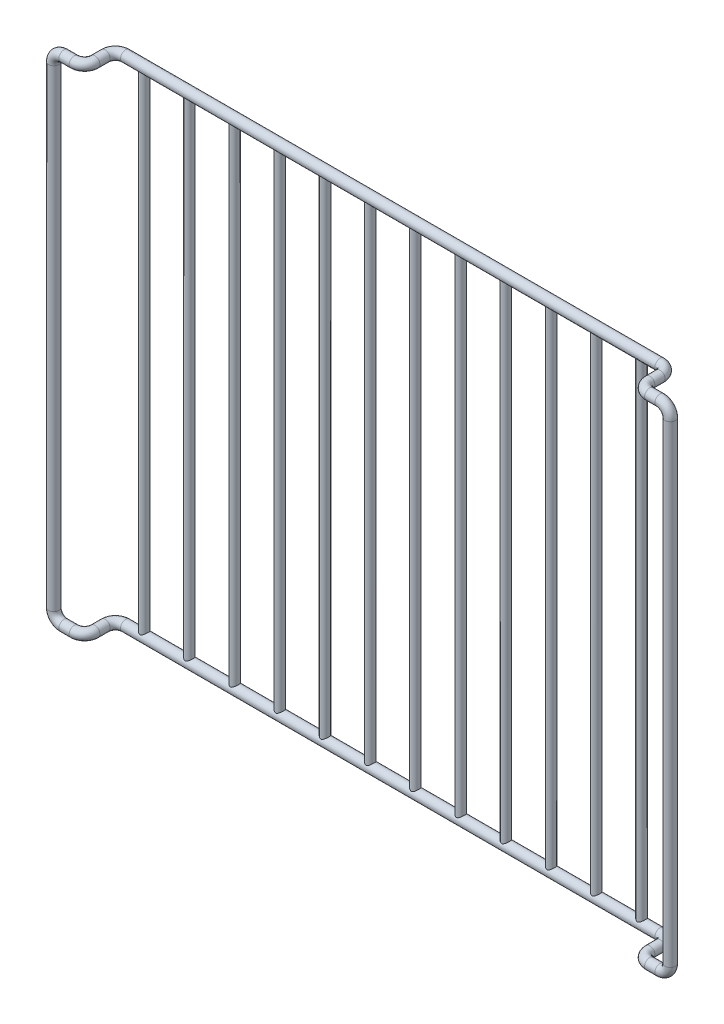
from build123d import *

# Parameters (mm, degrees)
SKETCH1_R                = 2.5
BOSS_EXTRUDE1_REACH      = 289
BOSS_EXTRUDE1_END_RADIUS = 2.5
SKETCH3_R                = 2
LPATTERN1_COUNT          = 6
LPATTERN1_PITCH          = 22


with BuildPart() as part:
    # Sweep1: sweep along a curve in space
    with BuildLine() as sweep1_path:
        Line((0, 0, 0), (130, 0, 0))
        ThreePointArc((135, 0, 5), (133.535533906, 0, 1.464466094), (130, 0, 0))
        Line((135, 0, 5), (135, 0, 10))
        ThreePointArc((140, 0, 15), (136.464466094, 0, 13.535533906), (135, 0, 10))
        Line((140, 0, 15), (145, 0, 15))
        ThreePointArc((145, 0, 15), (148.535533906, -1.464466094, 15), (150, -5, 15))
        Line((150, -5, 15), (150, -235, 15))
        ThreePointArc((150, -235, 15), (148.535533906, -238.535533906, 15), (145, -240, 15))
        Line((145, -240, 15), (140, -240, 15))
        ThreePointArc((140, -240, 15), (136.464466094, -240, 13.535533906), (135, -240, 10))
        Line((135, -240, 10), (135, -240, 5))
        ThreePointArc((135, -240, 5), (133.535533906, -240, 1.464466094), (130, -240, 0))
        Line((130, -240, 0), (0, -240, 0))
    # Sketch1 → Sweep1 (sweep)
    with BuildSketch(Plane(origin=(0, 0, 0), x_dir=(0, 0, -1), z_dir=(1, 0, 0))):
        Circle(SKETCH1_R)
    sweep(path=sweep1_path.line)

    # Boss-Extrude1: up to this cylinder (the profile starts outside it)
    boss_extrude1_end = Plane(origin=(11, -240, 0), z_dir=(-1, 0, 0)) * Cylinder(BOSS_EXTRUDE1_END_RADIUS, 584, mode=Mode.PRIVATE)
    # Sketch3 → Boss-Extrude1 (add, up to the surface)
    with BuildSketch(Plane(origin=(0, 0, 0), x_dir=(1, 0, 0), z_dir=(0, 1, 0)), mode=Mode.PRIVATE) as boss_extrude1_sk1:
        with Locations(Location((11, 0, 0), (0, 0, 270))):
            Circle(SKETCH3_R)
    boss_extrude1_tool1 = extrude(boss_extrude1_sk1.sketch, amount=-BOSS_EXTRUDE1_REACH, mode=Mode.PRIVATE) - boss_extrude1_end
    boss_extrude1 = boss_extrude1_tool1.solids().sort_by_distance((11, 0, 0))[0]
    add(boss_extrude1)

    # LPattern1: Boss-Extrude1 ×6
    with Locations(*[(i * LPATTERN1_PITCH, 0, 0) for i in range(1, LPATTERN1_COUNT)]):
        add(boss_extrude1)

    # Mirror1: part across plane


with BuildPart() as part_1:
    add(part.part)
    add(part.part.mirror(Plane(origin=(0, -240, 0), x_dir=(0, 0, 1), z_dir=(-1, 0, 0))))


solid = part_1.part
